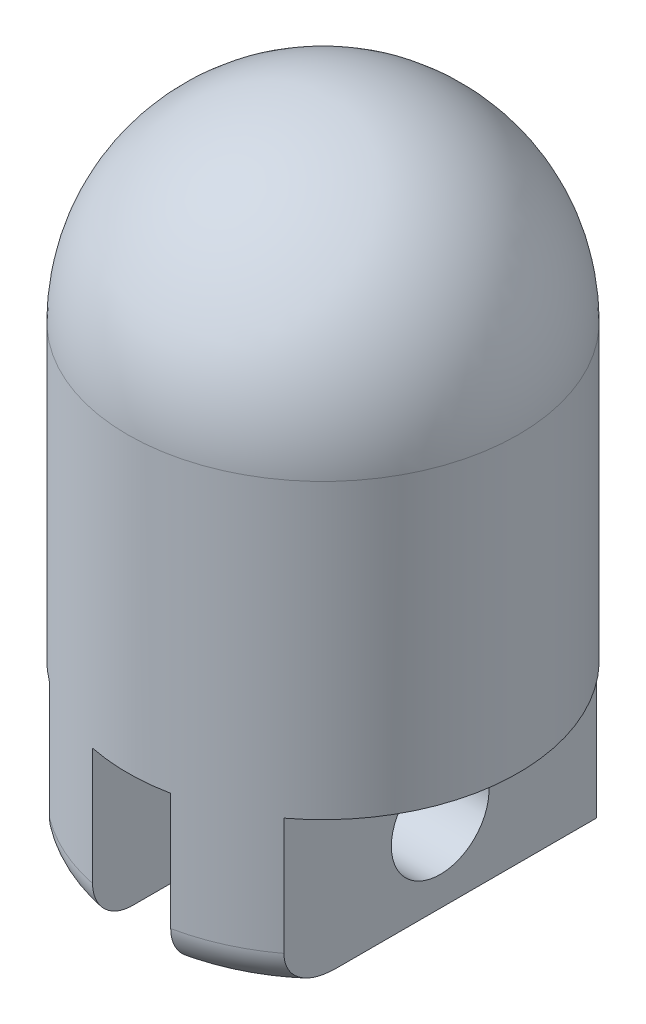
from build123d import *

# Parameters (mm, degrees)
CUT_EXTRUDE1_DEPTH = 10.16
SKETCH3_R          = 3.175
CUT_EXTRUDE2_DEPTH = 49.276707634
FILLET1_R          = 2.54


with BuildPart() as part:
    # Sketch1 → Revolve1 (revolve)
    with BuildSketch(Plane.XY):
        with BuildLine():
            Line((0, 0), (0, 5.602635041))
            Line((0, 5.602635041), (-2.54, 5.602635041))
            Line((-2.54, 5.602635041), (-2.54, 22.86))
            ThreePointArc((-2.54, 22.86), (-6.715756159, 30.503336463), (0, 36.049159305))
            Line((0, 36.049159305), (0, 41.91))
            ThreePointArc((0, 41.91), (-8.980256121, 38.190256121), (-12.7, 29.21))
            Line((-12.7, 29.21), (-12.7, 0))
            Line((-12.7, 0), (0, 0))
        make_face()
    revolve(axis=Axis((0, 0, 0), (0, 1, 0)))

    # Sketch2 → Cut-Extrude1 (cut)
    with BuildSketch(Plane.XZ):
        with BuildLine():
            Line((-2.54, 12.443407893), (-2.54, -12.443407893))
            ThreePointArc((-2.54, -12.443407893), (0, -12.7), (2.54, -12.443407893))
            Line((2.54, -12.443407893), (2.54, 12.443407893))
            ThreePointArc((2.54, 12.443407893), (0, 12.7), (-2.54, 12.443407893))
        make_face()
        with BuildLine():
            Line((-7.62, 10.16), (-7.62, -10.16))
            ThreePointArc((-7.62, -10.16), (-12.7, 0), (-7.62, 10.16))
        make_face()
        with BuildLine():
            Line((7.62, 10.16), (7.62, -10.16))
            ThreePointArc((7.62, -10.16), (12.7, 0), (7.62, 10.16))
        make_face()
    extrude(amount=-CUT_EXTRUDE1_DEPTH, mode=Mode.SUBTRACT)

    # Sketch3 → Cut-Extrude2 (cut, through all)
    with BuildSketch(Plane.ZY.offset(7.62)):
        with Locations((0, 5.08)):
            Circle(SKETCH3_R)
    extrude(amount=-CUT_EXTRUDE2_DEPTH, mode=Mode.SUBTRACT)

    # Fillet1
    fillet1_edges = [part.edges().sort_by_distance(p)[0] for p in [
        (5.206715654, 0, 11.583613948),
        (-5.206715654, 0, 11.583613948),
    ]]
    fillet(fillet1_edges, radius=FILLET1_R)


solid = part.part
